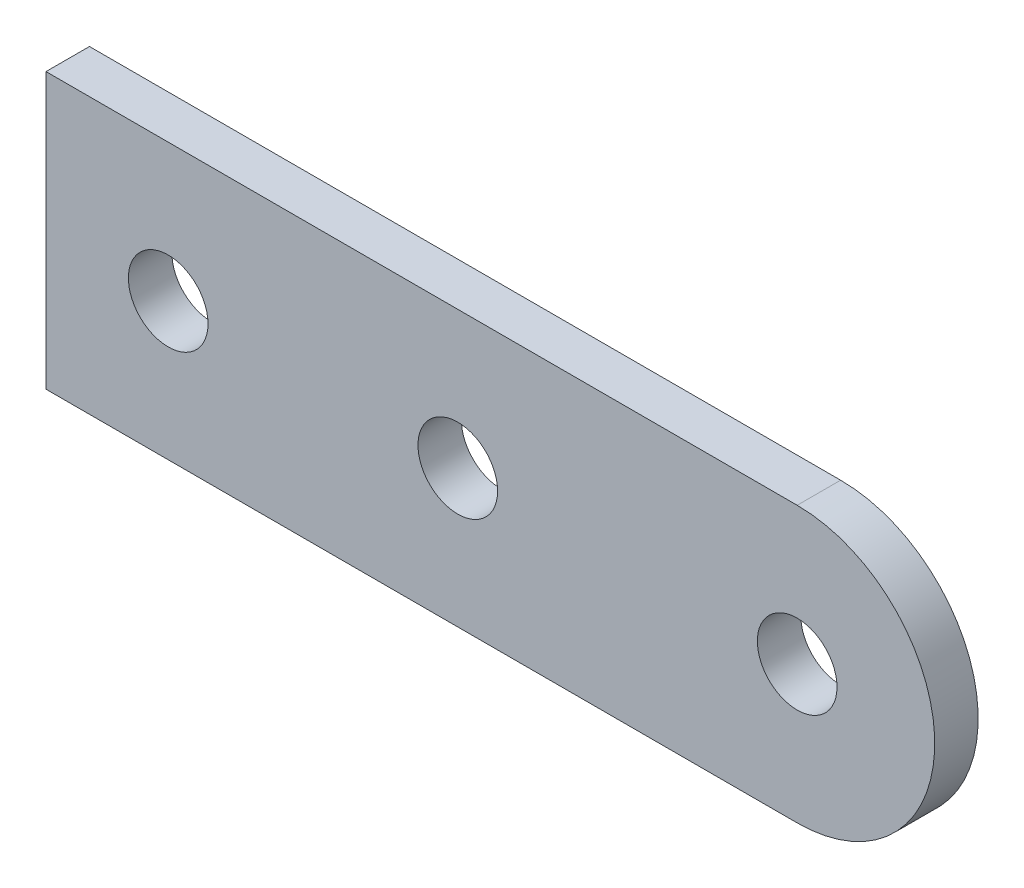
from build123d import *

# Parameters (mm, degrees)
BOSS_EXTRUDE1_DEPTH  = 3
M5_CLEARANCE_HOLE1_D = 5.5
M5_CLEARANCE_HOLE2_D = 5.5
M5_CLEARANCE_HOLE3_D = 5.5


with BuildPart() as part:
    # Sketch1 → Boss-Extrude1 (new body)
    with BuildSketch(Plane.XY):
        with BuildLine():
            Line((-51.88, -9.5), (0, -9.5))
            ThreePointArc((0, -9.5), (9.5, 0), (0, 9.5))
            Line((0, 9.5), (-51.88, 9.5))
            Line((-51.88, 9.5), (-51.88, -9.5))
        make_face()
    extrude(amount=BOSS_EXTRUDE1_DEPTH)

    # M5 Clearance Hole1 (through all)
    with Locations(Plane.XY.offset(3)):
        with Locations((-43.44, 0)):
            Hole(M5_CLEARANCE_HOLE1_D / 2)

    # M5 Clearance Hole2 (through all)
    with Locations(Plane.XY.offset(3)):
        with Locations((-23.44, 0)):
            Hole(M5_CLEARANCE_HOLE2_D / 2)

    # M5 Clearance Hole3 (through all)
    with Locations(Plane.XY.offset(3)):
        with Locations((0, 0)):
            Hole(M5_CLEARANCE_HOLE3_D / 2)


solid = part.part
